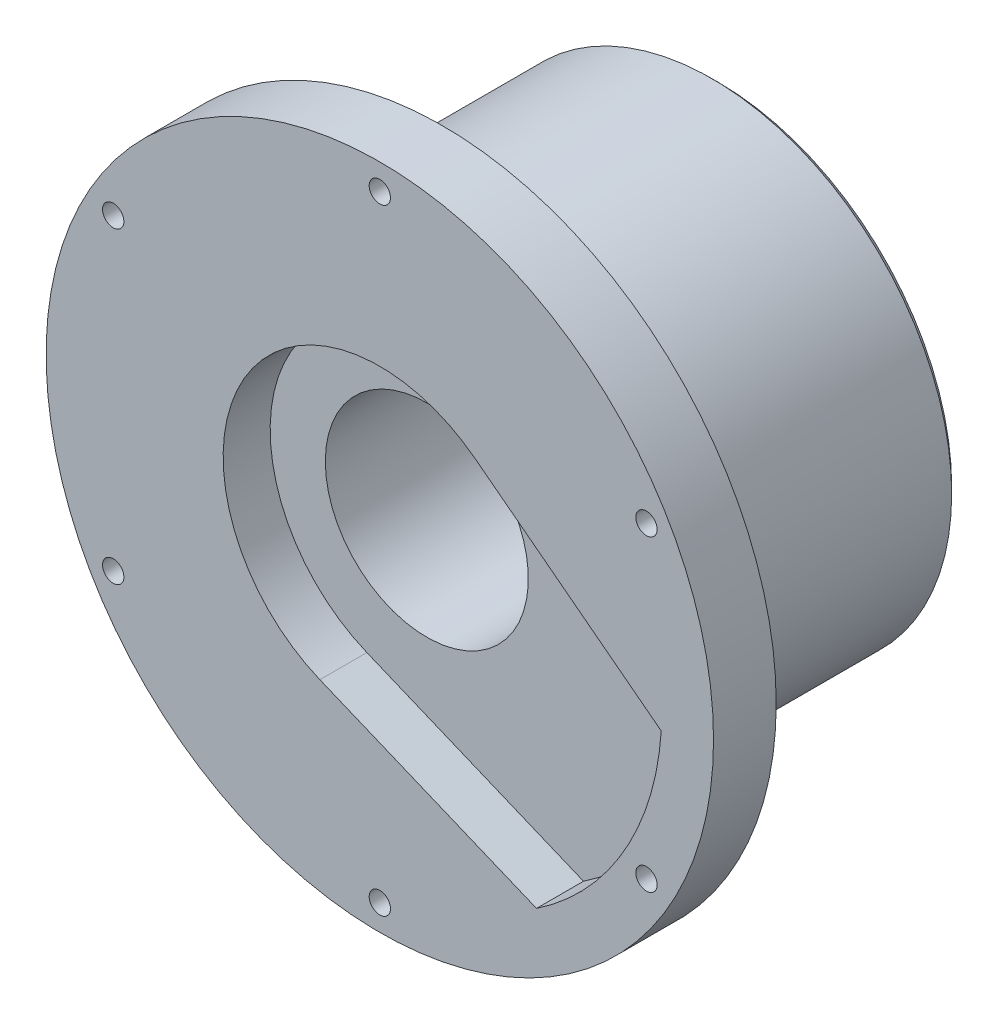
from build123d import *

# Parameters (mm, degrees)
SKETCH1_R            = 53.25
BOSS_EXTRUDE1_DEPTH  = 27
SKETCH2_OUTSIDE_W    = 140.5
SKETCH2_OUTSIDE_H    = 140.5
SKETCH2_OUTSIDE_R    = 38.25
CUT_EXTRUDE1_DEPTH   = 44
M3_CLEARANCE_HOLE2_D = 3.4
CIRPATTERN1_COUNT    = 6
CUT_EXTRUDE3_DEPTH   = 7.5
M3_CLEARANCE_HOLE1_D = 3.4
CUT_EXTRUDE4_DEPTH   = 2
CIRPATTERN2_COUNT    = 4
SKETCH14_R           = 11.7
CUT_EXTRUDE5_DEPTH   = 2
CHAMFER1_SIZE        = 1


with BuildPart() as part:
    # Sketch1 → Boss-Extrude1 (new, symmetric)
    with BuildSketch(Plane.XY):
        Circle(SKETCH1_R)
    extrude(amount=BOSS_EXTRUDE1_DEPTH, both=True)

    # Sketch2 outside → Cut-Extrude1 (cut)
    with BuildSketch(Plane(origin=(0, 0, -27), x_dir=(-1, 0, 0), z_dir=(0, 0, -1))):
        Rectangle(SKETCH2_OUTSIDE_W, SKETCH2_OUTSIDE_H)
        Circle(SKETCH2_OUTSIDE_R, mode=Mode.SUBTRACT)
    extrude(amount=-CUT_EXTRUDE1_DEPTH, mode=Mode.SUBTRACT)

    # M3 Clearance Hole2 (through all)
    with Locations(Plane.XY.offset(27)):
        with Locations((0, 49.125)):
            m3_clearance_hole2 = Hole(M3_CLEARANCE_HOLE2_D / 2)

    # CirPattern1: M3 Clearance Hole2 ×6 about axis
    cirpattern1_axis = Axis((0, 0, 0), (0, 0, 1))
    for i in range(1, CIRPATTERN1_COUNT):
        add(m3_clearance_hole2.rotate(cirpattern1_axis, i * 360 / CIRPATTERN1_COUNT), mode=Mode.SUBTRACT)

    # Sketch6 → Cut-Revolve1 (revolve, cut)
    with BuildSketch(Plane(origin=(0, 0, 0), x_dir=(0, 0, -1), z_dir=(1, 0, 0)), mode=Mode.PRIVATE) as cut_revolve1_sk:
        Polygon((27, 0), (-27, 0), (-27, 16.2), (21, 16.2), (21, 9.7), (27, 9.7), align=None)
    revolve(cut_revolve1_sk.sketch.rotate(Axis((0, 0, -27), (0, 0, 1)), 90), axis=Axis((0, 0, -27), (0, 0, 1)), mode=Mode.SUBTRACT)

    # Sketch11 → Cut-Extrude3 (cut)
    with BuildSketch(Plane.XY.offset(27)):
        with BuildLine():
            Line((-9.567085809, -23.096988313), (25.001320964, -37.415691228))
            ThreePointArc((25.001320964, -37.415691228), (38.97114317, -22.5), (44.903599585, -2.943933469))
            Line((44.903599585, -2.943933469), (15.219035725, 19.833833507))
            ThreePointArc((15.219035725, 19.833833507), (-21.650635095, 12.5), (-9.567085809, -23.096988313))
        make_face()
    extrude(amount=-CUT_EXTRUDE3_DEPTH, mode=Mode.SUBTRACT)

    # M3 Clearance Hole1 (through all)
    with Locations(Plane(origin=(0, 0, -27), x_dir=(-1, 0, 0), z_dir=(0, 0, -1))):
        with Locations((0, 13)):
            m3_clearance_hole1 = Hole(M3_CLEARANCE_HOLE1_D / 2)

    # Sketch13 → Cut-Extrude4 (cut)
    with BuildSketch(Plane(origin=(0, 0, -27), x_dir=(-1, 0, 0), z_dir=(0, 0, -1))):
        with BuildLine():
            Line((-3.55, 13), (-3.55, 9.027042705))
            ThreePointArc((-3.55, 9.027042705), (0, 9.7), (3.55, 9.027042705))
            Line((3.55, 9.027042705), (3.55, 13))
            ThreePointArc((3.55, 13), (0, 16.55), (-3.55, 13))
        make_face()
    cut_extrude4 = extrude(amount=-CUT_EXTRUDE4_DEPTH, mode=Mode.SUBTRACT)

    # CirPattern2: M3 Clearance Hole1, Cut-Extrude4 ×4 about axis
    cirpattern2_axis = Axis((0, 0, 0), (0, 0, 1))
    add([m3_clearance_hole1.rotate(cirpattern2_axis, i * 360 / CIRPATTERN2_COUNT) for i in range(1, CIRPATTERN2_COUNT)], mode=Mode.SUBTRACT)
    add([cut_extrude4.rotate(cirpattern2_axis, i * 360 / CIRPATTERN2_COUNT) for i in range(1, CIRPATTERN2_COUNT)], mode=Mode.SUBTRACT)

    # Sketch14 → Cut-Extrude5 (cut)
    with BuildSketch(Plane(origin=(0, 0, -27), x_dir=(-1, 0, 0), z_dir=(0, 0, -1))):
        Circle(SKETCH14_R)
    extrude(amount=-CUT_EXTRUDE5_DEPTH, mode=Mode.SUBTRACT)

    # Chamfer1
    chamfer1_edges = [part.edges().sort_by_distance(p)[0] for p in [
        (38.25, 0, -27),
    ]]
    chamfer(chamfer1_edges, length=CHAMFER1_SIZE)


solid = part.part
